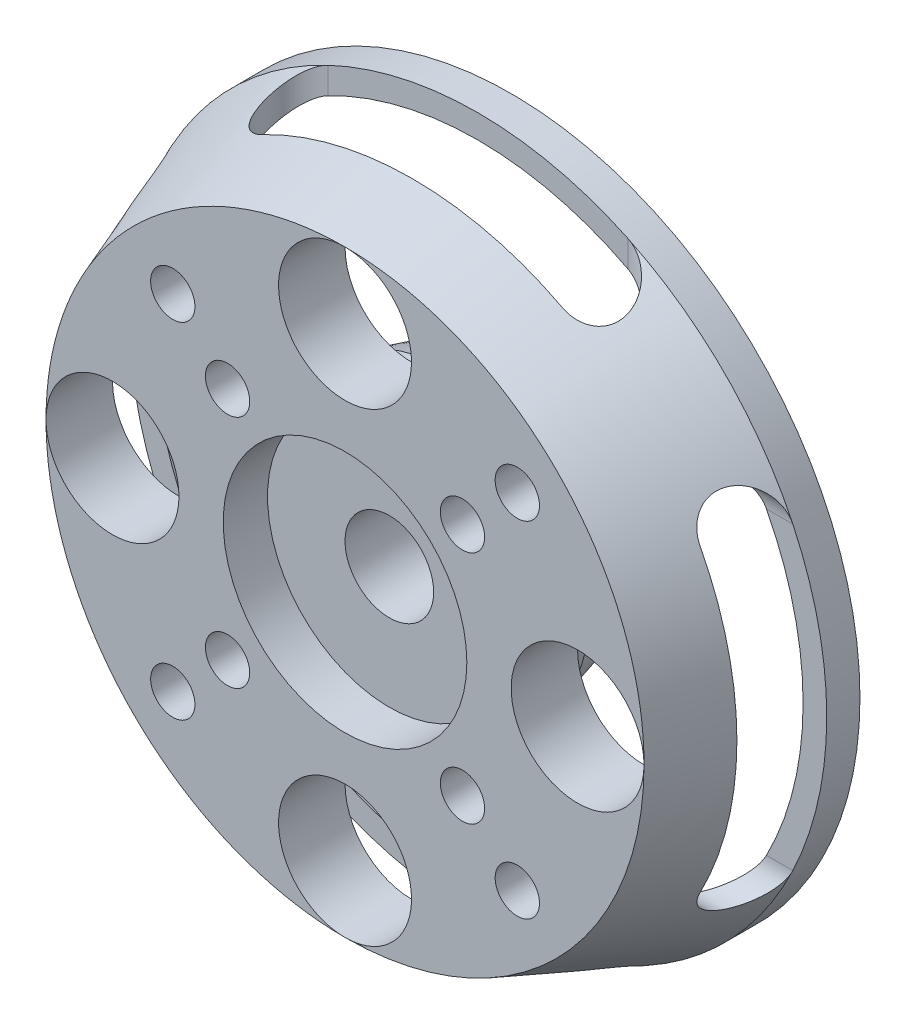
from build123d import *

# Parameters (mm, degrees)
CUT_EXTRUDE1_DEPTH = 10
CIRPATTERN1_COUNT  = 4
SKETCH3_R          = 6
SKETCH3_R_2        = 2
CUT_EXTRUDE2_DEPTH = 48.005318848


with BuildPart() as part:
    # Sketch1 → Revolve1 (revolve)
    with BuildSketch(Plane(origin=(0, 0, 0), x_dir=(1, 0, 0), z_dir=(0, 1, 0))):
        Polygon((29.5, 15), (29.5, 12.362669164), (27.113999064, 6), (13, 6), (13, 9), (11.392304845, 15), (4, 15), (4, 4), (11, 4), (11, 0), (27, 0), (31.5, 12), (31.5, 15), align=None)
    revolve(axis=Axis((0, 0, 76.888888889), (0, 0, -1)))

    # Sketch2 → Cut-Extrude1 (cut)
    with BuildSketch(Plane.ZY.offset(31.5)):
        with BuildLine():
            Line((-12, -13.55), (-12, 13.55))
            ThreePointArc((-12, 13.55), (-9.05, 16.5), (-6.1, 13.55))
            Line((-6.1, 13.55), (-6.1, -13.55))
            ThreePointArc((-6.1, -13.55), (-9.05, -16.5), (-12, -13.55))
        make_face()
    cut_extrude1 = extrude(amount=-CUT_EXTRUDE1_DEPTH, mode=Mode.SUBTRACT)

    # CirPattern1: Cut-Extrude1 ×4 about axis
    cirpattern1_axis = Axis((0, 0, -15.75), (0, 0, 1))
    for i in range(1, CIRPATTERN1_COUNT):
        add(cut_extrude1.rotate(cirpattern1_axis, i * 360 / CIRPATTERN1_COUNT), mode=Mode.SUBTRACT)

    # Sketch3 → Cut-Extrude2 (cut, through all)
    with BuildSketch(Plane.XY):
        with Locations(Location((-21, 0, 0), (0, 0, 180))):
            Circle(SKETCH3_R)
        with Locations(Location((0, 21, 0), (0, 0, 90.000375089))):
            Circle(SKETCH3_R)
        with Locations(Location((21, 0, 0), (0, 0, 0.000375109))):
            Circle(SKETCH3_R)
        with Locations(Location((0, -21, 0), (0, 0, 270.000375072))):
            Circle(SKETCH3_R)
        with Locations((-15.556349186, 15.556349186)):
            Circle(SKETCH3_R_2)
        with Locations((-10.606601718, 10.606601718)):
            Circle(SKETCH3_R_2)
        with Locations((10.606601718, 10.606601718)):
            Circle(SKETCH3_R_2)
        with Locations((15.556349186, 15.556349186)):
            Circle(SKETCH3_R_2)
        with Locations((10.606601718, -10.606601718)):
            Circle(SKETCH3_R_2)
        with Locations((15.556349186, -15.556349186)):
            Circle(SKETCH3_R_2)
        with Locations((-10.606601718, -10.606601718)):
            Circle(SKETCH3_R_2)
        with Locations((-15.556349186, -15.556349186)):
            Circle(SKETCH3_R_2)
    extrude(amount=-CUT_EXTRUDE2_DEPTH, mode=Mode.SUBTRACT)


solid = part.part
